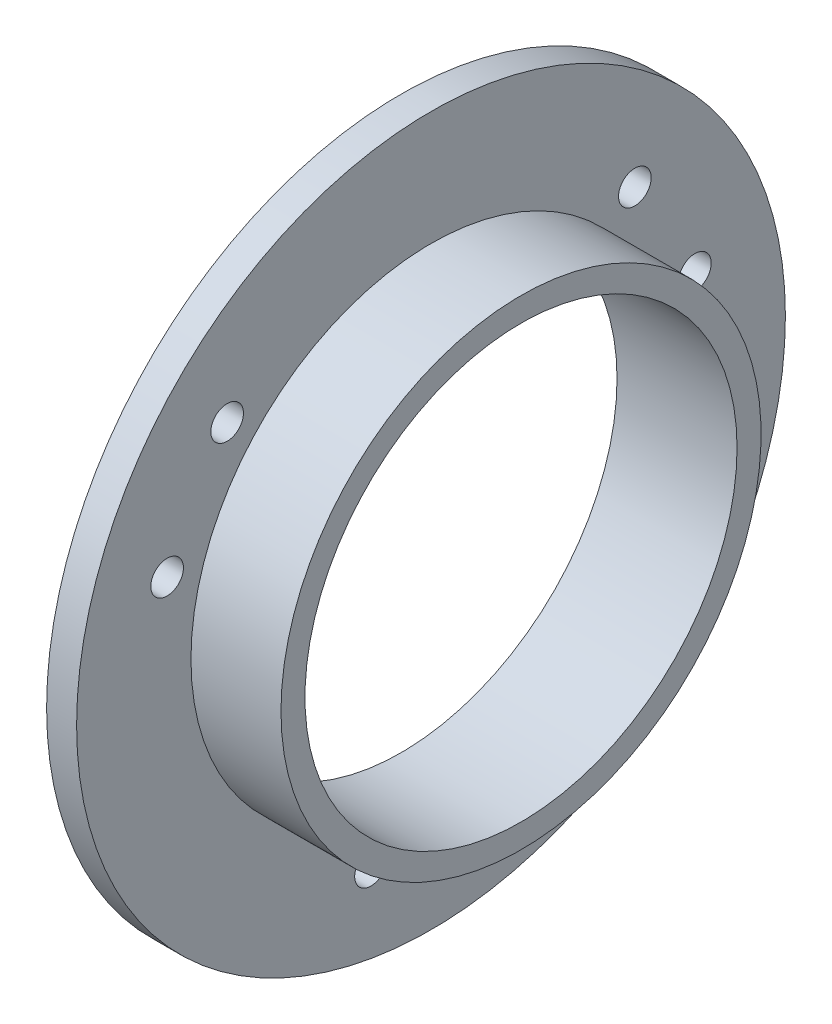
from build123d import *

# Parameters (mm, degrees)
SKETCH2_R           = 37.5
SKETCH2_R_2         = 1.7272
SKETCH2_R_3         = 22.86
BOSS_EXTRUDE1_DEPTH = 3.175
SKETCH3_R           = 25.4
SKETCH3_R_2         = 22.86
BOSS_EXTRUDE2_DEPTH = 9.525


with BuildPart() as part:
    # Sketch2 → Boss-Extrude1 (new body)
    with BuildSketch(Plane(origin=(0, 0, 0), x_dir=(0, 0, -1), z_dir=(1, 0, 0))):
        Circle(SKETCH2_R)
        with Locations((27.921675913, 8.788238686)):
            Circle(SKETCH2_R_2, mode=Mode.SUBTRACT)
        with Locations((21.571675913, 19.786761314)):
            Circle(SKETCH2_R_2, mode=Mode.SUBTRACT)
        with Locations((-21.571675913, 19.786761314)):
            Circle(SKETCH2_R_2, mode=Mode.SUBTRACT)
        with Locations((-27.921675913, 8.788238686)):
            Circle(SKETCH2_R_2, mode=Mode.SUBTRACT)
        with Locations((-6.35, -28.575)):
            Circle(SKETCH2_R_2, mode=Mode.SUBTRACT)
        with Locations((6.35, -28.575)):
            Circle(SKETCH2_R_2, mode=Mode.SUBTRACT)
        Circle(SKETCH2_R_3, mode=Mode.SUBTRACT)
    extrude(amount=BOSS_EXTRUDE1_DEPTH)

    # Sketch3 → Boss-Extrude2 (add)
    with BuildSketch(Plane(origin=(3.175, 0, 0), x_dir=(0, 0, -1), z_dir=(1, 0, 0))):
        with Locations(Location((0, 0, 0), (0, 0, 180))):
            Circle(SKETCH3_R)
        Circle(SKETCH3_R_2, mode=Mode.SUBTRACT)
    extrude(amount=BOSS_EXTRUDE2_DEPTH)


solid = part.part
